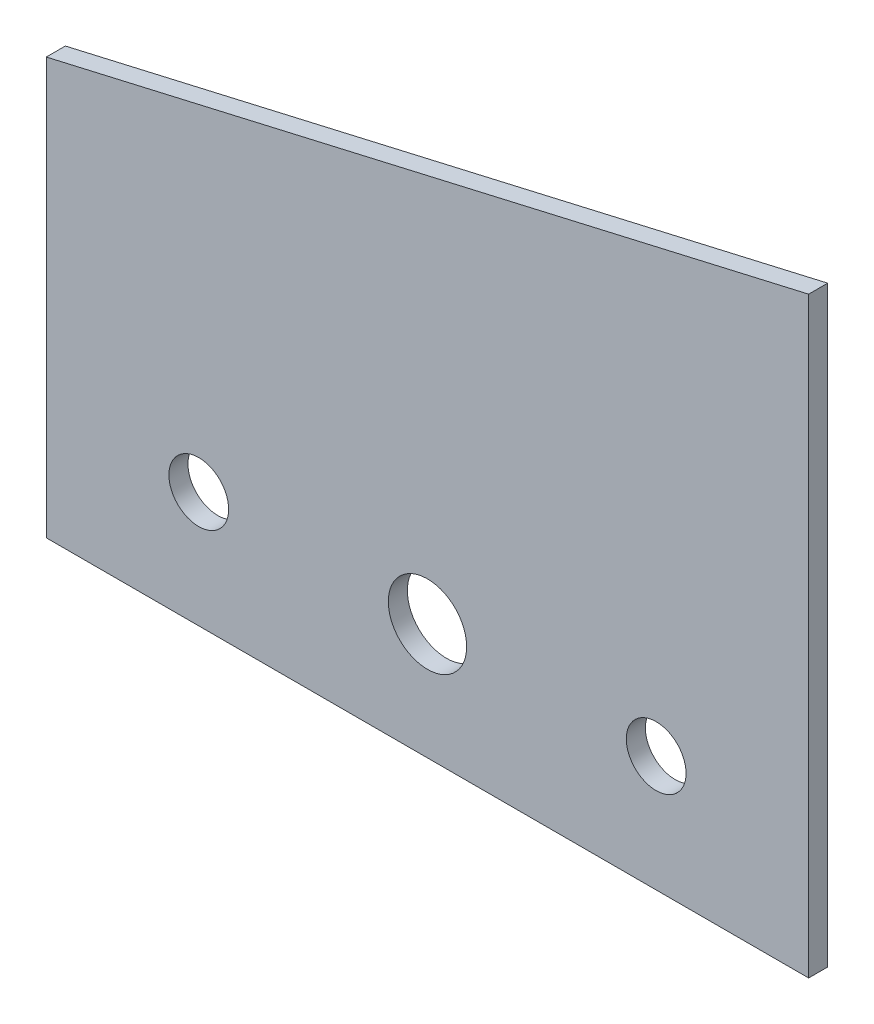
from build123d import *

# Parameters (mm, degrees)
SKETCH1_R           = 2.4892
SKETCH1_R_2         = 3.2639
BOSS_EXTRUDE1_DEPTH = 1.5875


with BuildPart() as part:
    # Sketch1 → Boss-Extrude1 (new body)
    with BuildSketch(Plane.XY):
        Polygon((1385.522288463, -68.984198863), (1385.522288463, -118.313538863), (1322.022288463, -118.313538863), (1322.022288463, -83.627447474), align=None)
        with Locations((1334.722288463, -108.661538863)):
            Circle(SKETCH1_R, mode=Mode.SUBTRACT)
        with Locations((1372.822288463, -108.661538863)):
            Circle(SKETCH1_R, mode=Mode.SUBTRACT)
        with Locations((1353.772288463, -108.661538863)):
            Circle(SKETCH1_R_2, mode=Mode.SUBTRACT)
    extrude(amount=BOSS_EXTRUDE1_DEPTH)


solid = part.part
